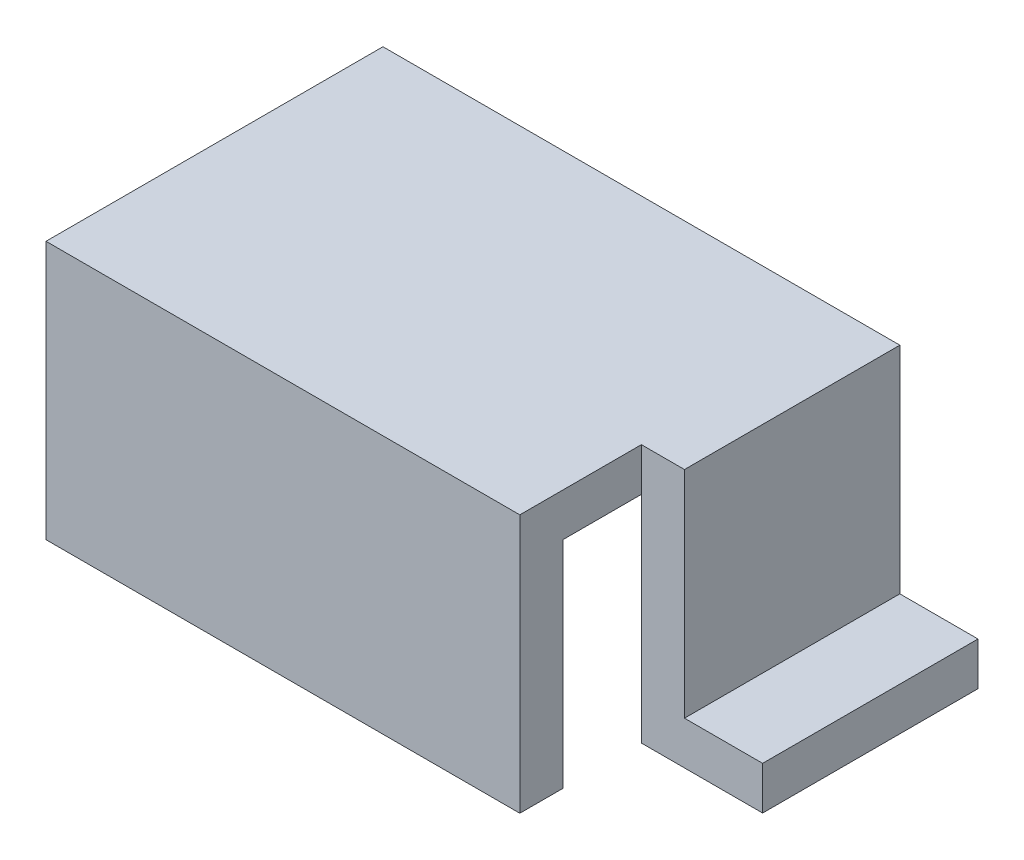
from build123d import *

# Parameters (mm, degrees)
BOSS_EXTRUDE1_DEPTH = 20
BOSS_EXTRUDE2_DEPTH = 4
BOSS_EXTRUDE3_DEPTH = 44


with BuildPart() as part:
    # Sketch1 → Boss-Extrude1 (new body)
    with BuildSketch(Plane.XY):
        Polygon((0, 0), (11.25748503, 0), (11.25748503, 20), (51.25748503, 20), (51.25748503, 0), (62.51497006, 0), (62.51497006, 4), (55.25748503, 4), (55.25748503, 24), (7.25748503, 24), (7.25748503, 4), (0, 4), align=None)
    extrude(amount=BOSS_EXTRUDE1_DEPTH)

    # Sketch2 → Boss-Extrude2 (add)
    with BuildSketch(Plane.ZY.offset(-7.25748503)):
        Polygon((27.29, 20), (20, 20), (20, 4), (20, 0), (27.29, 0), align=None)
        Polygon((20, 24), (20, 20), (27.29, 20), (27.29, 0), (31.29, 0), (31.29, 24), align=None)
    extrude(amount=-BOSS_EXTRUDE2_DEPTH)

    # Sketch2<3> → Boss-Extrude3 (add)
    with BuildSketch(Plane.ZY.offset(-7.25748503)):
        Polygon((20, 24), (20, 20), (27.29, 20), (27.29, 0), (31.29, 0), (31.29, 24), align=None)
    extrude(amount=-BOSS_EXTRUDE3_DEPTH)


solid = part.part
